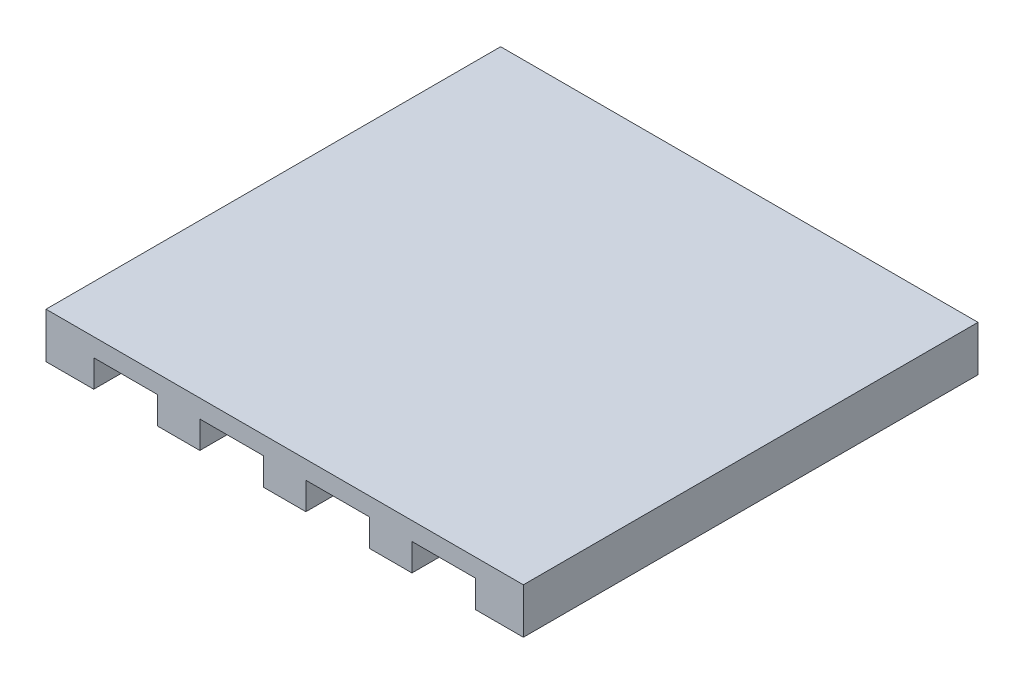
from build123d import *

# Parameters (mm, degrees)
SKETCH1_W           = 105
SKETCH1_H           = 100
BOSS_EXTRUDE1_DEPTH = 10
SKETCH2_W           = 14
SKETCH2_H           = 6
CUT_EXTRUDE1_DEPTH  = 35


with BuildPart() as part:
    # Sketch1 → Boss-Extrude1 (new body)
    with BuildSketch(Plane(origin=(0, 0, 0), x_dir=(1, 0, 0), z_dir=(0, 1, 0))):
        Rectangle(SKETCH1_W, SKETCH1_H)
    extrude(amount=BOSS_EXTRUDE1_DEPTH)

    # Sketch2 → Cut-Extrude1 (cut)
    with BuildSketch(Plane.XY.offset(50)):
        with Locations((-34.995, 3)):
            Rectangle(SKETCH2_W, SKETCH2_H)
        with Locations((-11.665, 3)):
            Rectangle(SKETCH2_W, SKETCH2_H)
        with Locations((34.995, 3)):
            Rectangle(SKETCH2_W, SKETCH2_H)
        with Locations((11.665, 3)):
            Rectangle(SKETCH2_W, SKETCH2_H)
    extrude(amount=-CUT_EXTRUDE1_DEPTH, mode=Mode.SUBTRACT)


solid = part.part
